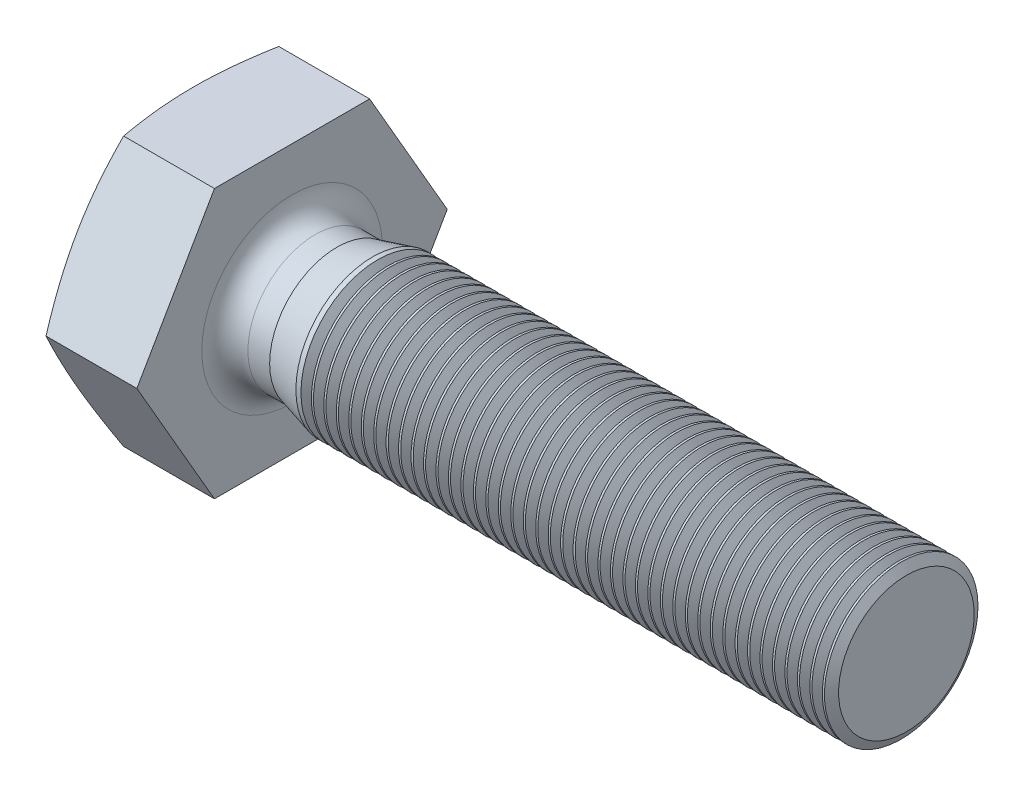
from build123d import *

# Parameters (mm, degrees)
BASEHEAD_DEPTH     = 2.8
SKETCH6_R          = 2.85
CUT_EXTRUDE1_DEPTH = 1
CUT_EXTRUDE2_DEPTH = 0.386
CIRPATTERN2_COUNT  = 2
CIRPATTERN2_ANGLE  = 90
LPATTERN10_COUNT   = 43
LPATTERN10_PITCH   = 0.3246


with BuildPart() as part:
    # Sketch2 → BaseHead (new body)
    with BuildSketch(Plane(origin=(0, 0, 0), x_dir=(0, 0, -1), z_dir=(1, 0, 0))):
        Polygon((2.020725942, -3.5), (4.041451884, 0), (2.020725942, 3.5), (-2.020725942, 3.5), (-4.041451884, 0), (-2.020725942, -3.5), align=None)
    extrude(amount=BASEHEAD_DEPTH)

    # Sketch10 → Revolve1 (revolve)
    with BuildSketch(Plane(origin=(0, 0, 0), x_dir=(1, 0, 0), z_dir=(0, 1, 0)), mode=Mode.PRIVATE) as revolve1_sk:
        with BuildLine():
            Line((2.8, 2.35), (2.8, 0))
            Line((2.8, 0), (18.8, 0))
            Line((18.8, 0), (18.8, 2))
            Line((18.8, 2), (4.9, 2))
            Line((4.9, 2), (3.966987298, 1.75))
            Line((3.966987298, 1.75), (3.4, 1.75))
            ThreePointArc((3.4, 1.75), (2.975735931, 1.925735931), (2.8, 2.35))
        make_face()
    revolve(revolve1_sk.sketch.rotate(Axis((0, 0, 0), (1, 0, 0)), 180), axis=Axis((0, 0, 0), (1, 0, 0)))

    # Sketch5 → HeadChamfer (revolve, cut)
    with BuildSketch(Plane(origin=(0, 0, 0), x_dir=(1, 0, 0), z_dir=(0, 1, 0)), mode=Mode.PRIVATE) as headchamfer_sk:
        Polygon((0, 4.041451884), (0.433653021, 4.041451884), (0, 2.85), align=None)
    revolve(headchamfer_sk.sketch.rotate(Axis((-0.358389262, 0, 0), (1, 0, 0)), 180), axis=Axis((-0.358389262, 0, 0), (1, 0, 0)), mode=Mode.SUBTRACT)

    # Sketch6 → Cut-Extrude1 (cut)
    with BuildSketch(Plane.ZY):
        Circle(SKETCH6_R)
    extrude(amount=-CUT_EXTRUDE1_DEPTH, mode=Mode.SUBTRACT)

    # Sketch7 → Cut-Extrude2 (cut, symmetric)
    with BuildSketch(Plane(origin=(0, 0, 0), x_dir=(1, 0, 0), z_dir=(0, 1, 0))):
        Polygon((2.93, 0), (0.5, 2.518134715), (0.5, -2.518134715), align=None)
    cut_extrude2 = extrude(amount=CUT_EXTRUDE2_DEPTH, both=True, mode=Mode.SUBTRACT)

    # CirPattern2: Cut-Extrude2 ×2 about axis
    cirpattern2_axis = Axis((0, 0, 0), (-1, 0, 0))
    for i in range(1, CIRPATTERN2_COUNT):
        add(cut_extrude2.rotate(cirpattern2_axis, i * CIRPATTERN2_ANGLE / (CIRPATTERN2_COUNT - 1)), mode=Mode.SUBTRACT)

    # Sketch8 → Cut-Revolve10 (revolve, cut)
    with BuildSketch(Plane.XY, mode=Mode.PRIVATE) as cut_revolve10_sk:
        Polygon((18.8, 1.765740128), (18.93525, 2), (18.93525, 2.2705), (18.66475, 2.2705), (18.66475, 2), align=None)
    cut_revolve10 = revolve(cut_revolve10_sk.sketch.rotate(Axis((14.8, 0, 0), (-1, 0, 0)), 270), axis=Axis((14.8, 0, 0), (-1, 0, 0)), mode=Mode.SUBTRACT)

    # LPattern10: Cut-Revolve10 ×43
    with Locations(*[(-i * LPATTERN10_PITCH, 0, 0) for i in range(1, LPATTERN10_COUNT)]):
        add(cut_revolve10, mode=Mode.SUBTRACT)


solid = part.part
